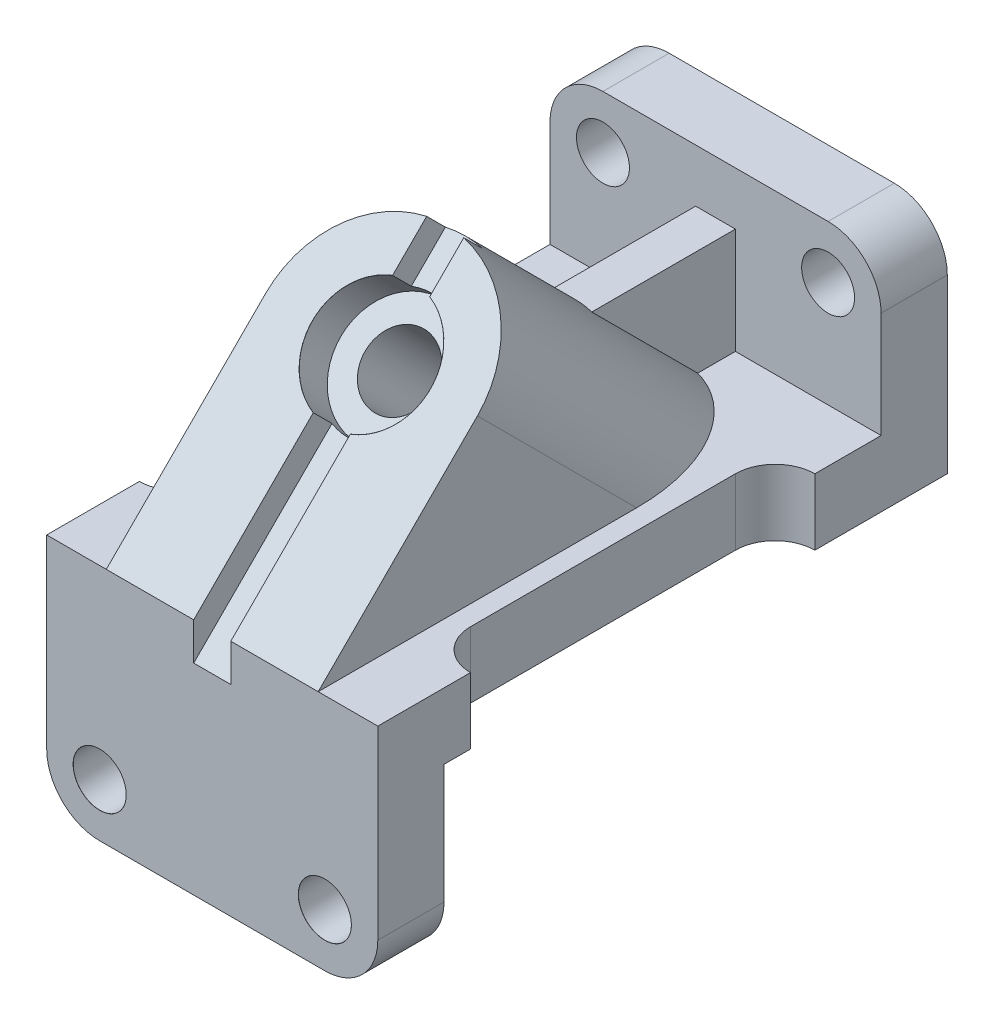
from build123d import *

# Parameters (mm, degrees)
BOSS_EXTRUDE1_DEPTH                  = 62.5
BOSS_EXTRUDE2_REACH                  = 289.283
SKETCH6_W                            = 14
SKETCH6_H                            = 267.143428259
CUT_EXTRUDE1_DEPTH                   = 10
RIB1_REACH                           = 288.004
SKETCH7_WALL_W                       = 627.230719128
SKETCH7_WALL_H                       = 15
FILLET1_R                            = 20
CUT_EXTRUDE2_DEPTH                   = 30
F_20_0_20_DIAMETER_HOLE1_D           = 20
F_20_0_20_DIAMETER_HOLE1_CSINK_D     = 20.05
F_20_0_20_DIAMETER_HOLE1_CSINK_ANGLE = 90
F_20_0_20_DIAMETER_HOLE2_D           = 20
F_20_0_20_DIAMETER_HOLE2_DEPTH       = 40
F_20_0_20_DIAMETER_HOLE2_CSINK_D     = 20.05
F_20_0_20_DIAMETER_HOLE2_CSINK_ANGLE = 90
F_20_0_20_DIAMETER_HOLE2_TIP         = 6.00860619


with BuildPart() as part:
    # Sketch1 → Boss-Extrude1 (new, symmetric)
    with BuildSketch(Plane(origin=(0, 0, 0), x_dir=(0, 0, -1), z_dir=(1, 0, 0))):
        Polygon((0, 0), (0, 90), (190, 90), (190, 150), (215, 150), (215, 65), (25, 65), (25, 0), align=None)
    extrude(amount=BOSS_EXTRUDE1_DEPTH, both=True)

    # Boss-Extrude2: up to this face of the body (flat: up to its plane)
    boss_extrude2_end = Plane(part.part.faces().sort_by_distance((0, 90, -95))[0])
    # Sketch2 → Boss-Extrude2 (add, up to the picked face)
    with BuildSketch(Plane(origin=(0, 45, 45), x_dir=(1, 0, 0), z_dir=(0, 0.7071067811865464, 0.7071067811865488)), mode=Mode.PRIVATE) as boss_extrude2_sk1:
        with BuildLine():
            Line((-40, 63.639610307), (-40, 148.639610307))
            ThreePointArc((-40, 148.639610307), (0, 188.639610307), (40, 148.639610307))
            Line((40, 148.639610307), (40, 63.639610307))
            Line((40, 63.639610307), (-40, 63.639610307))
        make_face()
    boss_extrude2_tool1 = split(extrude(boss_extrude2_sk1.sketch, amount=-BOSS_EXTRUDE2_REACH, mode=Mode.PRIVATE), bisect_by=boss_extrude2_end, keep=Keep.BOTH, mode=Mode.PRIVATE)
    add(boss_extrude2_tool1.solids().sort_by(Axis((0, 131.401312, -41.401312), (0, -0.7071067811865464, -0.7071067811865488)))[0])

    # Sketch5 → CBORE for M24 Hex Head Bolt1 (revolve, cut)
    with BuildSketch(Plane(origin=(0, 150.104076401, -60.104076401), x_dir=(0, -0.7071067811865487, 0.7071067811865465), z_dir=(1, 0, 0))):
        Polygon((0, 0), (0, 215.667568262), (13, 215.667568262), (13, 15), (22.2845, 15), (22.2845, 0.025), (22.3095, 0), align=None)
    revolve(axis=Axis((0, 154.594204461, -55.61394834), (0, -0.7071067811865465, -0.7071067811865486)), mode=Mode.SUBTRACT)

    # Sketch6 → Cut-Extrude1 (cut)
    with BuildSketch(Plane(origin=(0, 45, 45), x_dir=(1, 0, 0), z_dir=(0, 0.7071067811865465, 0.7071067811865487))):
        with Locations((0, 148.639610307)):
            Rectangle(SKETCH6_W, SKETCH6_H)
    extrude(amount=-CUT_EXTRUDE1_DEPTH, mode=Mode.SUBTRACT)

    # Sketch7 wall → Rib1 (add, up to next)
    with BuildSketch(Plane(origin=(0, 130, -163.388347649), x_dir=(0, 0, -1), z_dir=(0, 1, 0)), mode=Mode.PRIVATE) as rib1_sk1:
        Rectangle(SKETCH7_WALL_W, SKETCH7_WALL_H)
    rib1_tool1 = extrude(rib1_sk1.sketch, amount=-RIB1_REACH, mode=Mode.PRIVATE) - part.part
    add(rib1_tool1.solids().sort_by_distance((0, 130, -163.388347649))[0])

    # Fillet1
    fillet1_edges = [part.edges().sort_by_distance(p)[0] for p in [
        (62.5, 0, -12.5),
        (-62.5, 150, -202.5),
        (-62.5, 0, -12.5),
        (62.5, 150, -202.5),
    ]]
    fillet(fillet1_edges, radius=FILLET1_R)

    # Sketch8 → Cut-Extrude2 (cut)
    with BuildSketch(Plane(origin=(0, 90, 0), x_dir=(1, 0, 0), z_dir=(0, 1, 0))):
        with BuildLine():
            Line((77.5, 150), (77.5, 50))
            ThreePointArc((77.5, 50), (62.5, 35), (47.5, 50))
            Line((47.5, 50), (47.5, 150))
            ThreePointArc((47.5, 150), (62.5, 165), (77.5, 150))
        make_face()
        with BuildLine():
            Line((-77.5, 150), (-77.5, 50))
            ThreePointArc((-77.5, 50), (-62.5, 35), (-47.5, 50))
            Line((-47.5, 50), (-47.5, 150))
            ThreePointArc((-47.5, 150), (-62.5, 165), (-77.5, 150))
        make_face()
    extrude(amount=-CUT_EXTRUDE2_DEPTH, mode=Mode.SUBTRACT)

    # Ø20.0 (20) Diameter Hole1 (through all)
    with Locations(Plane.XY):
        with Locations((42.5, 20), (-42.5, 20)):
            CounterSinkHole(F_20_0_20_DIAMETER_HOLE1_D / 2, F_20_0_20_DIAMETER_HOLE1_CSINK_D / 2, counter_sink_angle=F_20_0_20_DIAMETER_HOLE1_CSINK_ANGLE)

    # Ø20.0 (20) Diameter Hole2
    with Locations(Plane(origin=(0, 0, -215), x_dir=(-1, 0, 0), z_dir=(0, 0, -1))):
        with Locations((-42.5, 130), (42.5, 130)):
            CounterSinkHole(F_20_0_20_DIAMETER_HOLE2_D / 2, F_20_0_20_DIAMETER_HOLE2_CSINK_D / 2, depth=F_20_0_20_DIAMETER_HOLE2_DEPTH, counter_sink_angle=F_20_0_20_DIAMETER_HOLE2_CSINK_ANGLE)
            with Locations((0, 0, -(F_20_0_20_DIAMETER_HOLE2_DEPTH + F_20_0_20_DIAMETER_HOLE2_TIP / 2))):  # 118° drill point
                Cone(0, F_20_0_20_DIAMETER_HOLE2_D / 2, F_20_0_20_DIAMETER_HOLE2_TIP, mode=Mode.SUBTRACT)


solid = part.part
